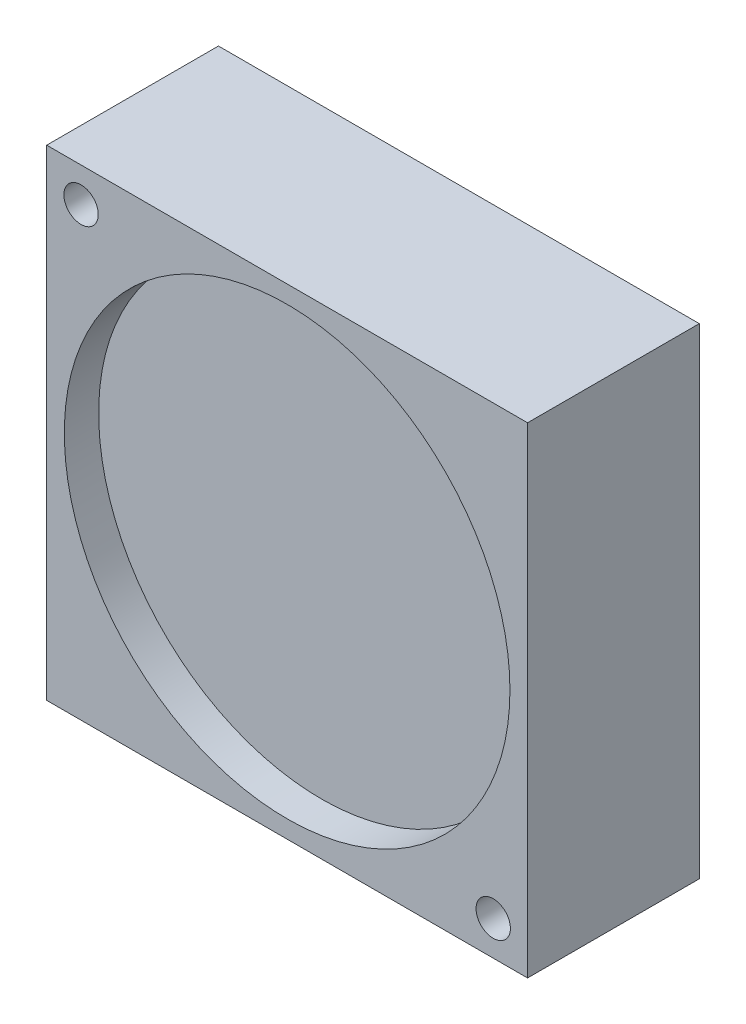
from build123d import *

# Parameters (mm, degrees)
SKETCH_1_W          = 28
SKETCH_1_H          = 28
SKETCH_1_R          = 1
EXTRUDE_1_DEPTH     = 10
SKETCH_2_R          = 12.974679672
CUT_EXTRUDE_1_DEPTH = 2


with BuildPart() as part:
    # 草图1 → 凸台-拉伸1 (new body)
    with BuildSketch(Plane.XY):
        Rectangle(SKETCH_1_W, SKETCH_1_H)
        with Locations((12, -12)):
            Circle(SKETCH_1_R, mode=Mode.SUBTRACT)
        with Locations((-12, 12)):
            Circle(SKETCH_1_R, mode=Mode.SUBTRACT)
    extrude(amount=EXTRUDE_1_DEPTH)

    # 草图2 → 切除-拉伸1 (cut)
    with BuildSketch(Plane.XY.offset(10)):
        Circle(SKETCH_2_R)
    extrude(amount=-CUT_EXTRUDE_1_DEPTH, mode=Mode.SUBTRACT)


solid = part.part
